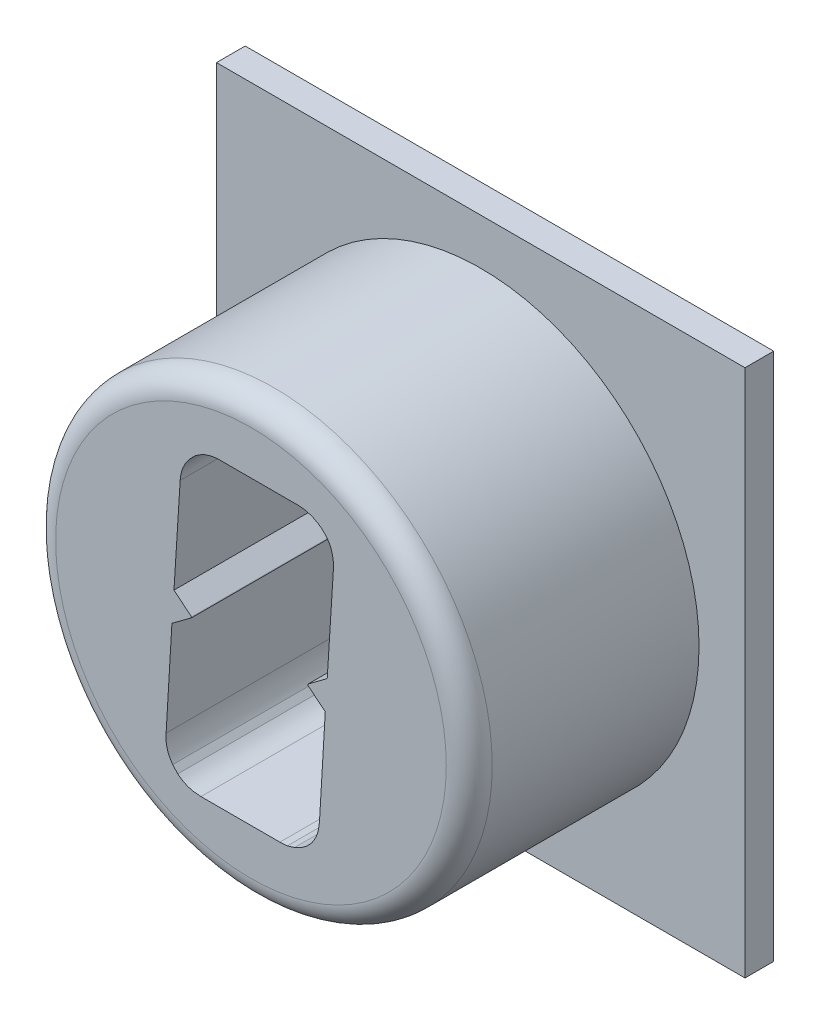
from build123d import *

# Parameters (mm, degrees)
SKETCH_1_R          = 3.8
EXTRUDE_1_DEPTH     = 4
SKETCH_2_W          = 9.2
SKETCH_2_H          = 9.2
EXTRUDE_2_DEPTH     = 0.5
FILLET_1_R          = 0.4
CUT_EXTRUDE_1_DEPTH = 4
CUT_EXTRUDE_2_DEPTH = 4
SKETCH_6_R          = 0.6
CUT_EXTRUDE_3_DEPTH = 8.636753289


with BuildPart() as part:
    # Эскиз1 → Бобышка-Вытянуть1 (new body)
    with BuildSketch(Plane.XY):
        Circle(SKETCH_1_R)
    extrude(amount=EXTRUDE_1_DEPTH)

    # Эскиз2 → Бобышка-Вытянуть2 (add)
    with BuildSketch(Plane(origin=(0, 0, 0), x_dir=(-1, 0, 0), z_dir=(0, 0, -1))):
        Rectangle(SKETCH_2_W, SKETCH_2_H)
    extrude(amount=EXTRUDE_2_DEPTH)

    # Скругление1
    fillet_1_edges = [part.edges().sort_by_distance(p)[0] for p in [
        (-3.8, 0, 4),
    ]]
    fillet(fillet_1_edges, radius=FILLET_1_R)

    # Эскиз3 → Вырез-Вытянуть1 (cut)
    with BuildSketch(Plane.XY.offset(4)):
        with BuildLine():
            Line((0.690974718, 1.998722557), (-0.494633441, 1.998722557))
            Line((-0.494633441, 1.998722557), (-0.967679121, 2.490729983))
            add(Edge.make_bspline(
                [(-0.967679121, 2.490729983), (-0.935743796, 2.513158419), (-0.873030504, 2.557202469), (-0.767844988, 2.603328706), (-0.657245689, 2.632663902), (-0.580977928, 2.635835465), (-0.542536801, 2.637434023)],
                knots=[0, 0, 0, 0, 1.020658978, 2.004328627, 2.994124718, 4, 4, 4, 4], degree=3))
            Line((-0.542536801, 2.637434023), (0.832688825, 2.637434023))
            Line((0.832688825, 2.637434023), (0.960431118, 2.624460196))
            Line((0.960431118, 2.624460196), (0.690974718, 1.998722557))
        make_face()
        with BuildLine():
            Line((0.783787478, 1.88096013), (1.080189518, 2.583542743))
            add(Edge.make_bspline(
                [(1.080189518, 2.583542743), (1.109972559, 2.568779947), (1.167520755, 2.540254577), (1.243334529, 2.484258604), (1.307175652, 2.420878144), (1.358952297, 2.349302652), (1.397359267, 2.268743846), (1.422764532, 2.180418501), (1.437519643, 2.084041158), (1.436172967, 2.017402915), (1.435472771, 1.98275477)],
                knots=[0, 0, 0, 0, 1.065948377, 2.059675685, 3.011626956, 3.94566096, 4.882319089, 5.862745984, 6.888747923, 8, 8, 8, 8], degree=3))
            Line((1.435472771, 1.98275477), (1.327690211, 0.277195558))
            Line((1.327690211, 0.277195558), (1.099151265, 0.106539838))
            Line((1.099151265, 0.106539838), (0.689976732, 0.433879465))
            Line((0.689976732, 0.433879465), (0.783787478, 1.88096013))
        make_face()
        with BuildLine():
            Line((0.639079412, -0.397443428), (1.085179451, -0.069105815))
            Line((1.085179451, -0.069105815), (1.293758665, -0.239761535))
            Line((1.293758665, -0.239761535), (1.192962011, -1.94432276))
            add(Edge.make_bspline(
                [(1.192962011, -1.94432276), (1.189491314, -1.97970738), (1.182773161, -2.048200607), (1.158848827, -2.146611673), (1.121568365, -2.235816828), (1.073168163, -2.317130934), (1.012395956, -2.389697225), (0.939872486, -2.454028672), (0.854949528, -2.509516087), (0.79219465, -2.538268676), (0.759835798, -2.553094627)],
                knots=[0, 0, 0, 0, 1.076355317, 2.083477241, 3.054916997, 3.995219207, 4.939832775, 5.910749548, 6.922701339, 8, 8, 8, 8], degree=3))
            Line((0.759835798, -2.553094627), (0.544270678, -1.848516041))
            Line((0.544270678, -1.848516041), (0.639079412, -0.397443428))
        make_face()
        with BuildLine():
            Line((-0.742134134, -1.961288534), (0.442476038, -1.961288534))
            Line((0.442476038, -1.961288534), (0.631095518, -2.593014093))
            Line((0.631095518, -2.593014093), (0.503353225, -2.6))
            Line((0.503353225, -2.6), (-0.869876427, -2.6))
            add(Edge.make_bspline(
                [(-0.869876427, -2.6), (-0.907959732, -2.598286355), (-0.982390401, -2.594937176), (-1.089588752, -2.568328401), (-1.188525215, -2.524510079), (-1.245499134, -2.481728782), (-1.274061027, -2.460281867)],
                knots=[0, 0, 0, 0, 1.046522757, 2.045342129, 3.020100256, 4, 4, 4, 4], degree=3))
            Line((-1.274061027, -2.460281867), (-0.742134134, -1.961288534))
        make_face()
        with BuildLine():
            Line((-0.827960987, -1.857497921), (-1.361883854, -2.364475147))
            add(Edge.make_bspline(
                [(-1.361883854, -2.364475147), (-1.382559986, -2.334279014), (-1.423593096, -2.274352853), (-1.460868358, -2.170727201), (-1.480865064, -2.060535537), (-1.47807852, -1.984986172), (-1.47665232, -1.946318734)],
                knots=[0, 0, 0, 0, 0.987067533, 1.958898816, 2.955330013, 4, 4, 4, 4], degree=3))
            Line((-1.47665232, -1.946318734), (-1.375855667, -0.240759522))
            Line((-1.375855667, -0.240759522), (-1.14432276, -0.069105815))
            Line((-1.14432276, -0.069105815), (-0.733152254, -0.398441415))
            Line((-0.733152254, -0.398441415), (-0.827960987, -1.857497921))
        make_face()
        with BuildLine():
            Line((-0.684250907, 0.434877451), (-1.131348934, 0.106539838))
            Line((-1.131348934, 0.106539838), (-1.339928147, 0.277195558))
            Line((-1.339928147, 0.277195558), (-1.232145587, 1.984750744))
            add(Edge.make_bspline(
                [(-1.232145587, 1.984750744), (-1.228217454, 2.022627769), (-1.220457829, 2.097449969), (-1.184381891, 2.204509013), (-1.134468518, 2.306511141), (-1.086053255, 2.365165228), (-1.061489867, 2.394923263)],
                knots=[0, 0, 0, 0, 1.007070456, 1.989364909, 2.979908279, 4, 4, 4, 4], degree=3))
            Line((-1.061489867, 2.394923263), (-0.590440161, 1.888944024))
            Line((-0.590440161, 1.888944024), (-0.684250907, 0.434877451))
        make_face()
        Polygon((-1.043526107, 0.018717012), (-0.598424054, 0.338072745), (0.593172025, 0.338072745), (0.997356625, 0.018717012), (0.553252558, -0.300638722), (-0.639341507, -0.300638722), align=None)
    extrude(amount=-CUT_EXTRUDE_1_DEPTH, mode=Mode.SUBTRACT)

    # Эскиз5 → Вырез-Вытянуть2 (cut)
    with BuildSketch(Plane.XY.offset(4)):
        with BuildLine():
            Line((1.080189518, 2.583542743), (0.960431118, 2.624460196))
            Line((0.960431118, 2.624460196), (0.832688825, 2.637434023))
            Line((0.832688825, 2.637434023), (-0.542536801, 2.637434023))
            add(Edge.make_bspline(
                [(-0.967679121, 2.490729983), (-0.935743796, 2.513158419), (-0.873030504, 2.557202469), (-0.767844988, 2.603328706), (-0.657245689, 2.632663902), (-0.580977928, 2.635835465), (-0.542536801, 2.637434023)],
                knots=[0, 0, 0, 0, 0.255164744, 0.501082157, 0.74853118, 1, 1, 1, 1], degree=3))
            Line((-0.967679121, 2.490729983), (-1.061489867, 2.394923263))
            add(Edge.make_bspline(
                [(-1.232145587, 1.984750744), (-1.228217454, 2.022627769), (-1.220457829, 2.097449969), (-1.184381891, 2.204509013), (-1.134468518, 2.306511141), (-1.086053255, 2.365165228), (-1.061489867, 2.394923263)],
                knots=[0, 0, 0, 0, 0.251767614, 0.497341227, 0.74497707, 1, 1, 1, 1], degree=3))
            Line((-1.232145587, 1.984750744), (-1.339928147, 0.277195558))
            Line((-1.339928147, 0.277195558), (-1.131348934, 0.106539838))
            Line((-1.131348934, 0.106539838), (-1.024891339, 0.01943817))
            Line((-1.024891339, 0.01943817), (-1.14432276, -0.069105815))
            Line((-1.14432276, -0.069105815), (-1.375855667, -0.240759522))
            Line((-1.375855667, -0.240759522), (-1.47665232, -1.946318734))
            add(Edge.make_bspline(
                [(-1.361883854, -2.364475147), (-1.382559986, -2.334279014), (-1.423593096, -2.274352853), (-1.460868358, -2.170727201), (-1.480865064, -2.060535537), (-1.47807852, -1.984986172), (-1.47665232, -1.946318734)],
                knots=[0, 0, 0, 0, 0.246766883, 0.489724704, 0.738832503, 1, 1, 1, 1], degree=3))
            Line((-1.361883854, -2.364475147), (-1.274061027, -2.460281867))
            add(Edge.make_bspline(
                [(-0.869876427, -2.6), (-0.907959732, -2.598286355), (-0.982390401, -2.594937176), (-1.089588752, -2.568328401), (-1.188525215, -2.524510079), (-1.245499134, -2.481728782), (-1.274061027, -2.460281867)],
                knots=[0, 0, 0, 0, 0.261630689, 0.511335532, 0.755025064, 1, 1, 1, 1], degree=3))
            Line((-0.869876427, -2.6), (0.503353225, -2.6))
            Line((0.503353225, -2.6), (0.631095518, -2.593014093))
            Line((0.631095518, -2.593014093), (0.759835798, -2.553094627))
            add(Edge.make_bspline(
                [(1.192962011, -1.94432276), (1.189491314, -1.97970738), (1.182773161, -2.048200607), (1.158848827, -2.146611673), (1.121568365, -2.235816828), (1.073168163, -2.317130934), (1.012395956, -2.389697225), (0.939872486, -2.454028672), (0.854949528, -2.509516087), (0.79219465, -2.538268676), (0.759835798, -2.553094627)],
                knots=[0, 0, 0, 0, 0.134544415, 0.260434655, 0.381864625, 0.499402401, 0.617479097, 0.738843694, 0.865337667, 1, 1, 1, 1], degree=3))
            Line((1.192962011, -1.94432276), (1.293758665, -0.239761535))
            Line((1.293758665, -0.239761535), (1.085179451, -0.069105815))
            Line((1.085179451, -0.069105815), (0.979606032, 0.017272437))
            Line((0.979606032, 0.017272437), (1.099151265, 0.106539838))
            Line((1.099151265, 0.106539838), (1.327690211, 0.277195558))
            Line((1.327690211, 0.277195558), (1.435472771, 1.98275477))
            add(Edge.make_bspline(
                [(1.080189518, 2.583542743), (1.109972559, 2.568779947), (1.167520755, 2.540254577), (1.243334529, 2.484258604), (1.307175652, 2.420878144), (1.358952297, 2.349302652), (1.397359267, 2.268743846), (1.422764532, 2.180418501), (1.437519643, 2.084041158), (1.436172967, 2.017402915), (1.435472771, 1.98275477)],
                knots=[0, 0, 0, 0, 0.133243547, 0.257459461, 0.376453369, 0.49320762, 0.610289886, 0.732843248, 0.86109349, 1, 1, 1, 1], degree=3))
        make_face()
    extrude(amount=-CUT_EXTRUDE_2_DEPTH, mode=Mode.SUBTRACT)

    # Эскиз6 → Вырез-Вытянуть3 (cut, through all)
    with BuildSketch(Plane.XY):
        Circle(SKETCH_6_R)
    extrude(amount=-CUT_EXTRUDE_3_DEPTH, mode=Mode.SUBTRACT)


solid = part.part
